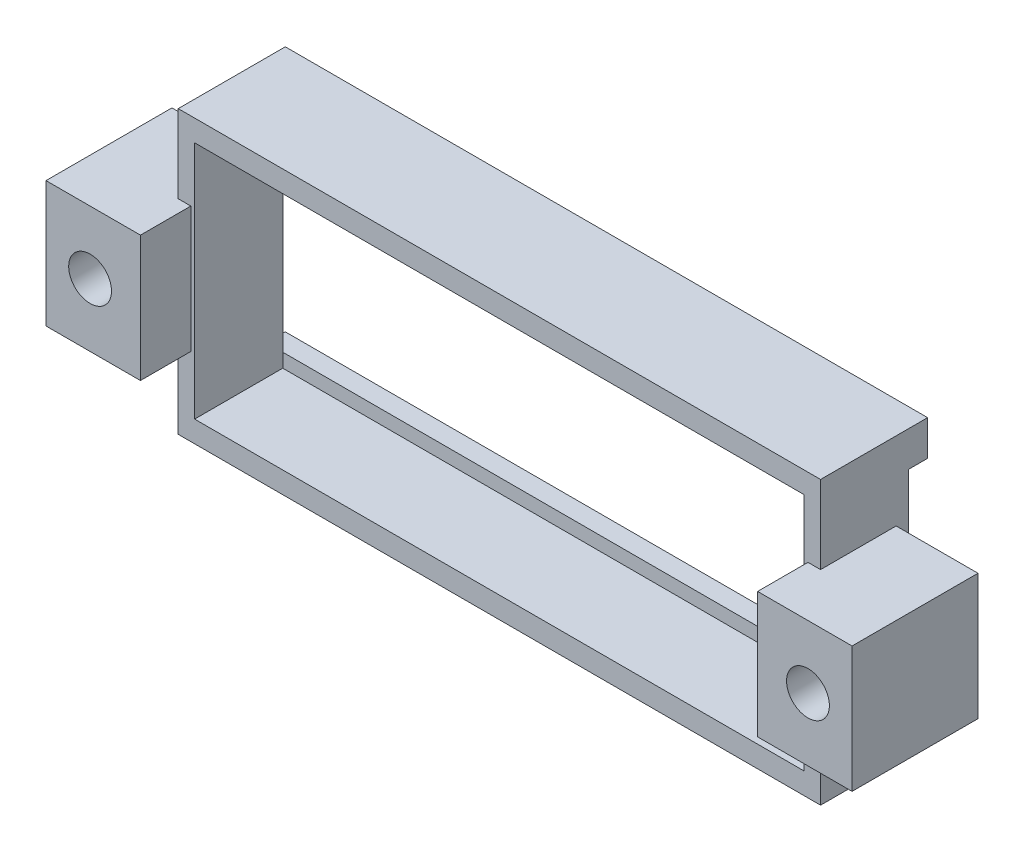
from build123d import *

# Parameters (mm, degrees)
GRAY_HOUSING_PERIMETER_RETENTION_START = 11
SKETCH_1_W                             = 51
SKETCH_1_H                             = 22.4
SKETCH_1_W_2                           = 48.4
SKETCH_1_H_2                           = 19
GRAY_HOUSING_PERIMETER_RETENTION_DEPTH = 7
GRAY_LOWER_EDGE_RETAINING_LIPS_START   = 9.5
SKETCH_2_W                             = 51
SKETCH_2_H                             = 2.8
GRAY_LOWER_EDGE_RETAINING_LIPS_DEPTH   = 1.5
GRAY_MOUNTING_ENDS_TO_DECK_START       = 12
SKETCH_5_W                             = 7.5
SKETCH_5_H                             = 10
GRAY_MOUNTING_ENDS_TO_DECK_DEPTH       = 10
GRAY_M3_MOUNTS_START                   = 23
SKETCH_6_R                             = 1.7
GRAY_M3_MOUNTS_DEPTH                   = 12


with BuildPart() as part:
    # 草图1 → Gray_housing_perimeter_retention (new body)
    with BuildSketch(Plane.XY.offset(GRAY_HOUSING_PERIMETER_RETENTION_START)):
        Rectangle(SKETCH_1_W, SKETCH_1_H)
        Rectangle(SKETCH_1_W_2, SKETCH_1_H_2, mode=Mode.SUBTRACT)
    extrude(amount=GRAY_HOUSING_PERIMETER_RETENTION_DEPTH)

    # 草图2 → Gray_lower_edge_retaining_lips (add)
    with BuildSketch(Plane.XY.offset(GRAY_LOWER_EDGE_RETAINING_LIPS_START)):
        with Locations((0, -9.8)):
            Rectangle(SKETCH_2_W, SKETCH_2_H)
        with Locations((0, 9.8)):
            Rectangle(SKETCH_2_W, SKETCH_2_H)
    extrude(amount=GRAY_LOWER_EDGE_RETAINING_LIPS_DEPTH)

    # 草图5 → Gray_mounting_ends_to_deck (add)
    with BuildSketch(Plane.XY.offset(GRAY_MOUNTING_ENDS_TO_DECK_START)):
        with Locations((-28.25, 0)):
            Rectangle(SKETCH_5_W, SKETCH_5_H)
        with Locations((28.25, 0)):
            Rectangle(SKETCH_5_W, SKETCH_5_H)
    extrude(amount=GRAY_MOUNTING_ENDS_TO_DECK_DEPTH)

    # 草图6 → Gray_M3_mounts (cut)
    with BuildSketch(Plane.XY.offset(GRAY_M3_MOUNTS_START)):
        with Locations(Location((-28.5, 0, 0), (0, 0, 180))):
            Circle(SKETCH_6_R)
        with Locations(Location((28.5, 0, 0), (0, 0, 180))):
            Circle(SKETCH_6_R)
    extrude(amount=-GRAY_M3_MOUNTS_DEPTH, mode=Mode.SUBTRACT)


solid = part.part
